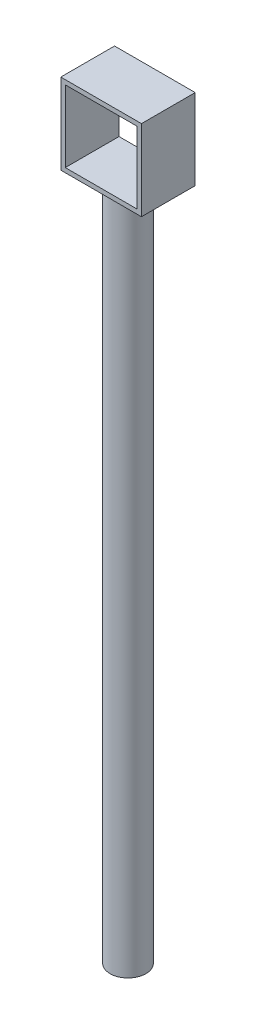
from build123d import *

# Parameters (mm, degrees)
SKETCH1_W           = 57.15
SKETCH1_H           = 57.15
SKETCH1_W_2         = 50.8
SKETCH1_H_2         = 50.8
BOSS_EXTRUDE1_DEPTH = 38.1
SKETCH4_R           = 12.7
BOSS_EXTRUDE2_DEPTH = 482.6


with BuildPart() as part:
    # Sketch1 → Boss-Extrude1 (new body)
    with BuildSketch(Plane.XY):
        Rectangle(SKETCH1_W, SKETCH1_H)
        Rectangle(SKETCH1_W_2, SKETCH1_H_2, mode=Mode.SUBTRACT)
    extrude(amount=BOSS_EXTRUDE1_DEPTH)

    # Sketch4 → Boss-Extrude2 (add)
    with BuildSketch(Plane(origin=(0, -27.94, 0), x_dir=(1, 0, 0), z_dir=(0, 1, 0))):
        with Locations(Location((0, -19.05, 0), (0, 0, 270))):
            Circle(SKETCH4_R)
    extrude(amount=-BOSS_EXTRUDE2_DEPTH)


solid = part.part
